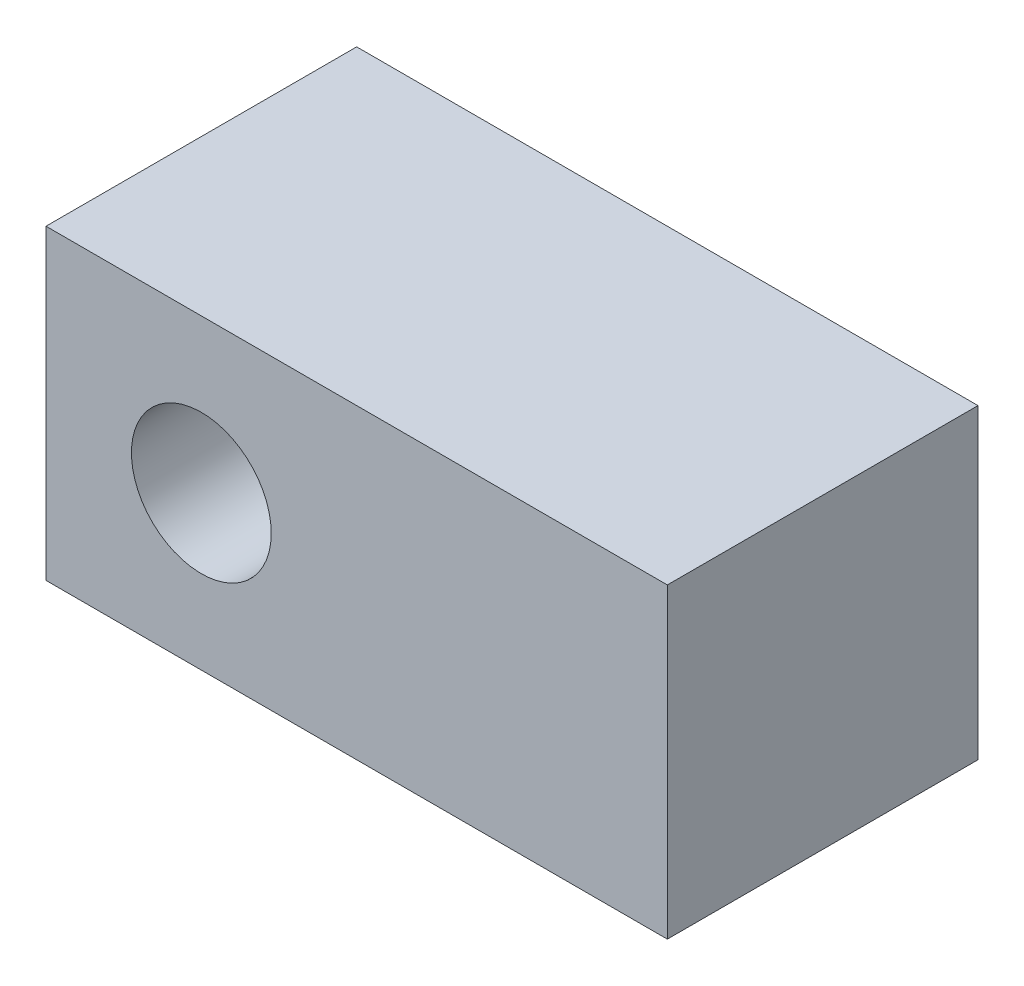
from build123d import *

# Parameters (mm, degrees)
SKETCH1_W           = 40
SKETCH1_H           = 19.748892406
SKETCH1_R           = 4.5
BOSS_EXTRUDE1_DEPTH = 20


with BuildPart() as part:
    # Sketch1 → Boss-Extrude1 (new body)
    with BuildSketch(Plane.XY):
        with Locations((20, 9.874446203)):
            Rectangle(SKETCH1_W, SKETCH1_H)
        with Locations((10, 9.874446203)):
            Circle(SKETCH1_R, mode=Mode.SUBTRACT)
    extrude(amount=BOSS_EXTRUDE1_DEPTH)


solid = part.part
